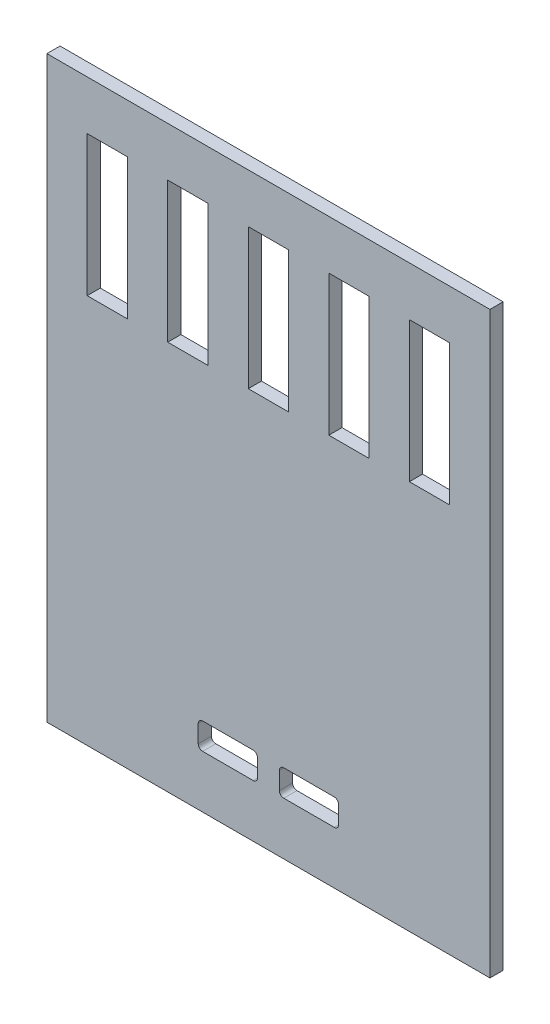
from build123d import *

# Parameters (mm, degrees)
SKETCH1_W           = 101
SKETCH1_H           = 132
BOSS_EXTRUDE1_DEPTH = 1.5
SKETCH2_W           = 9.181818182
SKETCH2_H           = 32
CUT_EXTRUDE1_DEPTH  = 84.157982179


with BuildPart() as part:
    # Sketch1 → Boss-Extrude1 (new, symmetric)
    with BuildSketch(Plane.XY):
        Rectangle(SKETCH1_W, SKETCH1_H)
    extrude(amount=BOSS_EXTRUDE1_DEPTH, both=True)

    # Sketch2 → Cut-Extrude1 (cut, through all)
    with BuildSketch(Plane.XY.offset(1.5)):
        with BuildLine():
            Line((3.5, -54), (15, -54))
            ThreePointArc((15, -54), (15.707106781, -53.707106781), (16, -53))
            Line((16, -53), (16, -49))
            ThreePointArc((16, -49), (15.707106781, -48.292893219), (15, -48))
            Line((15, -48), (3.5, -48))
            ThreePointArc((3.5, -48), (2.792893219, -48.292893219), (2.5, -49))
            Line((2.5, -49), (2.5, -53))
            ThreePointArc((2.5, -53), (2.792893219, -53.707106781), (3.5, -54))
        make_face()
        with Locations((-36.727272727, 38.8)):
            Rectangle(SKETCH2_W, SKETCH2_H)
        with Locations((-18.363636364, 38.8)):
            Rectangle(SKETCH2_W, SKETCH2_H)
        with Locations((0, 38.8)):
            Rectangle(SKETCH2_W, SKETCH2_H)
        with Locations((18.363636364, 38.8)):
            Rectangle(SKETCH2_W, SKETCH2_H)
        with Locations((36.727272727, 38.8)):
            Rectangle(SKETCH2_W, SKETCH2_H)
        with BuildLine():
            Line((-15, -54), (-3.5, -54))
            ThreePointArc((-3.5, -54), (-2.792893219, -53.707106781), (-2.5, -53))
            Line((-2.5, -53), (-2.5, -49))
            ThreePointArc((-2.5, -49), (-2.792893219, -48.292893219), (-3.5, -48))
            Line((-3.5, -48), (-15, -48))
            ThreePointArc((-15, -48), (-15.707106781, -48.292893219), (-16, -49))
            Line((-16, -49), (-16, -53))
            ThreePointArc((-16, -53), (-15.707106781, -53.707106781), (-15, -54))
        make_face()
    extrude(amount=-CUT_EXTRUDE1_DEPTH, mode=Mode.SUBTRACT)


solid = part.part
